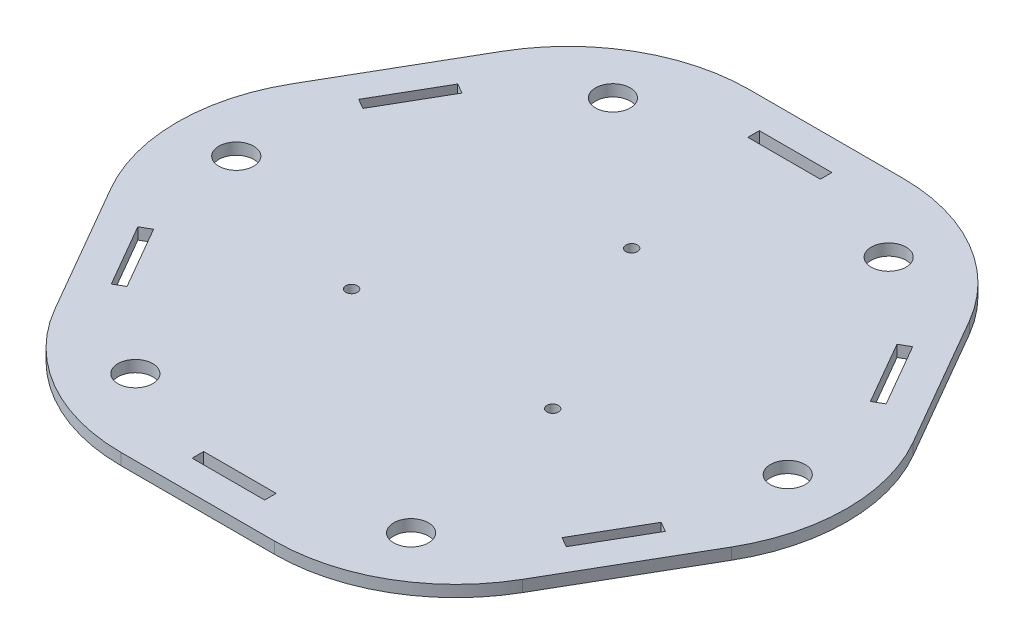
from build123d import *

# Parameters (mm, degrees)
SKETCH1_W           = 40
SKETCH1_H           = 6.35
BOSS_EXTRUDE1_DEPTH = 6.35
SKETCH2_R           = 3.2
CUT_EXTRUDE1_DEPTH  = 6.35
SKETCH3_R           = 9.5885
CUT_EXTRUDE2_DEPTH  = 254.16323495


with BuildPart() as part:
    # Sketch1 → Boss-Extrude1 (new body)
    with BuildSketch(Plane(origin=(0, 0, 0), x_dir=(1, 0, 0), z_dir=(0, 1, 0))):
        with BuildLine():
            Line((171.132486541, 50), (128.867513459, 123.205080757))
            ThreePointArc((128.867513459, 123.205080757), (92.264973081, 159.807621135), (42.264973081, 173.205080757))
            Line((42.264973081, 173.205080757), (-42.264973081, 173.205080757))
            ThreePointArc((-42.264973081, 173.205080757), (-92.264973081, 159.807621135), (-128.867513459, 123.205080757))
            Line((-128.867513459, 123.205080757), (-171.132486541, 50))
            ThreePointArc((-171.132486541, 50), (-184.529946162, 0), (-171.132486541, -50))
            Line((-171.132486541, -50), (-128.867513459, -123.205080757))
            ThreePointArc((-128.867513459, -123.205080757), (-92.264973081, -159.807621135), (-42.264973081, -173.205080757))
            Line((-42.264973081, -173.205080757), (42.264973081, -173.205080757))
            ThreePointArc((42.264973081, -173.205080757), (92.264973081, -159.807621135), (128.867513459, -123.205080757))
            Line((128.867513459, -123.205080757), (171.132486541, -50))
            ThreePointArc((171.132486541, -50), (184.529946162, 0), (171.132486541, 50))
        make_face()
        with Locations((0, -153.175)):
            Rectangle(SKETCH1_W, SKETCH1_H, mode=Mode.SUBTRACT)
        Polygon((-139.903810568, -57.679491924), (-145.403071882, -60.854491924), (-125.403071882, -95.495508076), (-119.903810568, -92.320508076), align=None, mode=Mode.SUBTRACT)
        Polygon((-119.903810568, 92.320508076), (-125.403071882, 95.495508076), (-145.403071882, 60.854491924), (-139.903810568, 57.679491924), align=None, mode=Mode.SUBTRACT)
        with Locations((0, 153.175)):
            Rectangle(SKETCH1_W, SKETCH1_H, mode=Mode.SUBTRACT)
        Polygon((139.903810568, 57.679491924), (145.403071882, 60.854491924), (125.403071882, 95.495508076), (119.903810568, 92.320508076), align=None, mode=Mode.SUBTRACT)
        Polygon((119.903810568, -92.320508076), (125.403071882, -95.495508076), (145.403071882, -60.854491924), (139.903810568, -57.679491924), align=None, mode=Mode.SUBTRACT)
    extrude(amount=BOSS_EXTRUDE1_DEPTH)

    # Sketch2 → Cut-Extrude1 (cut)
    with BuildSketch(Plane(origin=(0, 6.35, 0), x_dir=(1, 0, 0), z_dir=(0, 1, 0))):
        with Locations(Location((55.794244464, -33.346698257, 0), (0, 0, 270))):
            Circle(SKETCH2_R)
        with Locations(Location((-56.776210055, -31.645883963, 0), (0, 0, 270))):
            Circle(SKETCH2_R)
        with Locations(Location((0.981965591, 64.99258222, 0), (0, 0, 270))):
            Circle(SKETCH2_R)
    extrude(amount=-CUT_EXTRUDE1_DEPTH, mode=Mode.SUBTRACT)

    # Sketch3 → Cut-Extrude2 (cut, through all)
    with BuildSketch(Plane(origin=(0, 6.35, 0), x_dir=(1, 0, 0), z_dir=(0, 1, 0))):
        with Locations(Location((76, 131.635861375, 0), (0, 0, 270))):
            Circle(SKETCH3_R)
        with Locations(Location((152, 0, 0), (0, 0, 270))):
            Circle(SKETCH3_R)
        with Locations(Location((76, -131.635861375, 0), (0, 0, 270))):
            Circle(SKETCH3_R)
        with Locations(Location((-76, -131.635861375, 0), (0, 0, 270))):
            Circle(SKETCH3_R)
        with Locations(Location((-152, 0, 0), (0, 0, 270))):
            Circle(SKETCH3_R)
        with Locations(Location((-76, 131.635861375, 0), (0, 0, 270))):
            Circle(SKETCH3_R)
    extrude(amount=-CUT_EXTRUDE2_DEPTH, mode=Mode.SUBTRACT)


solid = part.part
